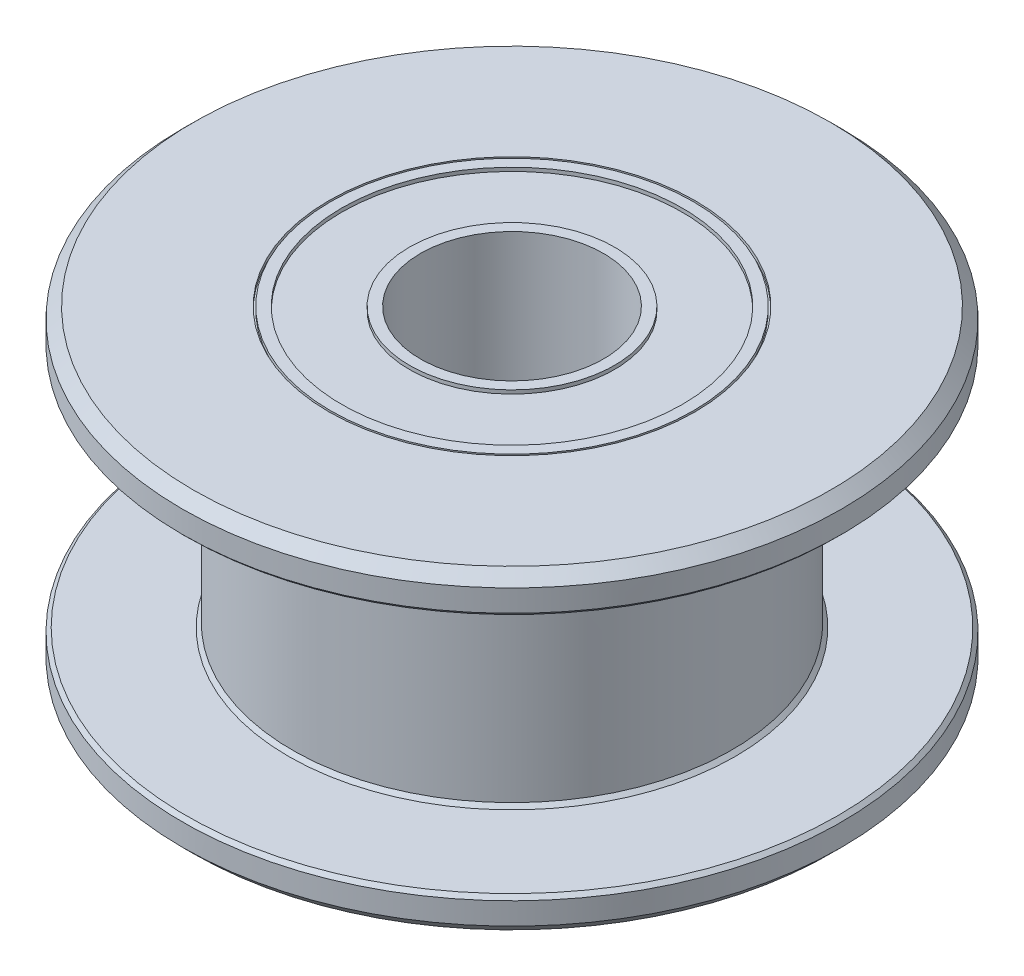
from build123d import *

# Parameters (mm, degrees)
CHAFL_N3_SIZE = 0.3
CHAFL_N4_SIZE = 0.1


with BuildPart() as part:
    # Croquis1 → Revolución3 (revolve)
    with BuildSketch(Plane.XY, mode=Mode.PRIVATE) as revoluci_n3_sk:
        Polygon((6.5, -20.750745615), (2.5, -20.750745615), (2.5, -20.850745615), (2.45, -20.850745615), (2.45, -20.750745615), (2.15, -20.750745615), (2.15, -20.850745615), (0.3, -20.850745615), (0.3, -20.750745615), (0, -20.750745615), (0, -20.850745615), (0, -29.250745615), (1.690218344, -29.250745615), (1.690218344, -29.350745615), (6.5, -29.350745615), (6.5, -28.350745615), (3.5, -28.350745615), (3.5, -21.750745615), (6.5, -21.750745615), align=None)
    revolve(revoluci_n3_sk.sketch.rotate(Axis((-2.5, -20.750745615, 0), (0, -1, 0)), 180), axis=Axis((-2.5, -20.750745615, 0), (0, -1, 0)))

    # Chaflán3
    chafl_n3_edges = [part.edges().sort_by_distance(p)[0] for p in [
        (6.5, -29.350745615, 0),
        (6.5, -20.750745615, 0),
    ]]
    chamfer(chafl_n3_edges, length=CHAFL_N3_SIZE)

    # Chaflán4
    chafl_n4_edges = [part.edges().sort_by_distance(p)[0] for p in [
        (6.5, -28.350745615, 0),
        (3.5, -28.350745615, 0),
        (6.5, -21.750745615, 0),
    ]]
    chamfer(chafl_n4_edges, length=CHAFL_N4_SIZE)


solid = part.part
